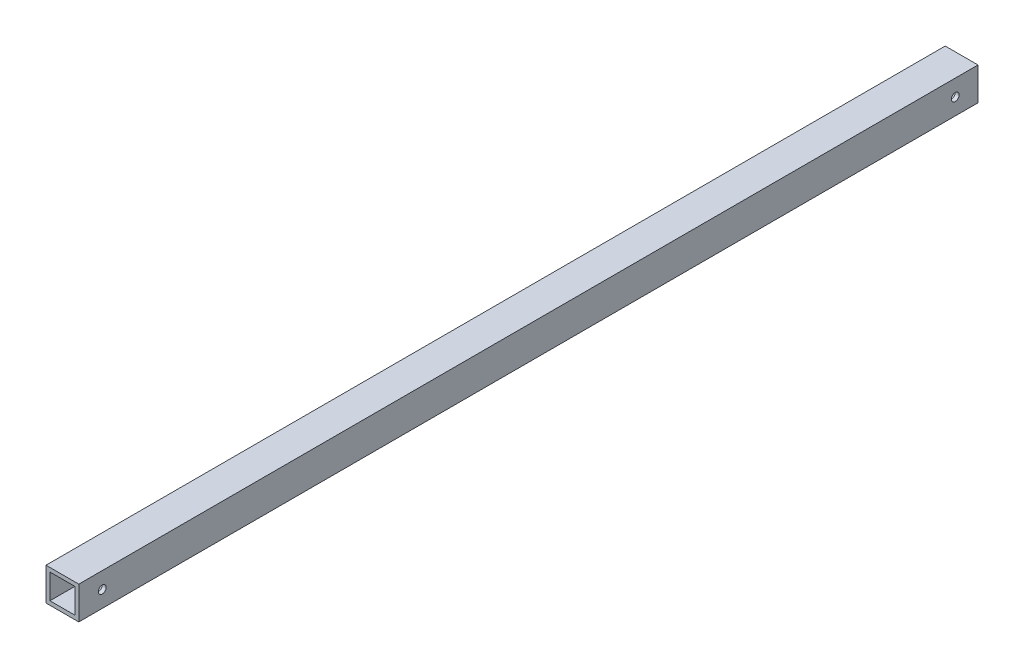
from build123d import *

# Parameters (mm, degrees)
SKETCH_1_W             = 25
SKETCH_1_H             = 25
SKETCH_1_W_2           = 19
SKETCH_1_H_2           = 19
EXTRUDE_1_DEPTH        = 685.5
HOLE_WIZARD_6_0_6_1_D  = 6
CUT_EXTRUDE_1_REACH    = 688.411
SKETCH_5_R             = 6
PATTERN_LINEAR_1_COUNT = 2
PATTERN_LINEAR_1_PITCH = 650.3


with BuildPart() as part:
    # 草图1 → 拉伸1 (new body)
    with BuildSketch(Plane.XY):
        with Locations((12.5, -12.5)):
            Rectangle(SKETCH_1_W, SKETCH_1_H)
        with Locations((12.5, -12.5)):
            Rectangle(SKETCH_1_W_2, SKETCH_1_H_2, mode=Mode.SUBTRACT)
    extrude(amount=EXTRUDE_1_DEPTH)

    # Ø6.0 (6) 直径孔1 (through all)
    with Locations(Plane(origin=(25, 0, 0), x_dir=(0, 0, -1), z_dir=(1, 0, 0))):
        with Locations((-667.65, -12.5)):
            hole_wizard_6_0_6_1 = Hole(HOLE_WIZARD_6_0_6_1_D / 2)

    # 草图5 → 切除-拉伸1 (cut, up to next)
    with BuildSketch(Plane.ZY, mode=Mode.PRIVATE) as cut_extrude_1_sk1:
        with Locations(Location((667.65, -12.5, 0), (0, 0, 270))):
            Circle(SKETCH_5_R)
    cut_extrude_1_tool1 = extrude(cut_extrude_1_sk1.sketch, amount=-CUT_EXTRUDE_1_REACH, mode=Mode.PRIVATE) & part.part
    cut_extrude_1 = cut_extrude_1_tool1.solids().sort_by_distance((0, -12.5, 667.65))[0]
    add(cut_extrude_1, mode=Mode.SUBTRACT)

    # 阵列(线性)1: Ø6.0 (6) 直径孔1, 切除-拉伸1 ×2
    with Locations(*[(0, 0, -i * PATTERN_LINEAR_1_PITCH) for i in range(1, PATTERN_LINEAR_1_COUNT)]):
        add(hole_wizard_6_0_6_1, mode=Mode.SUBTRACT)
        add(cut_extrude_1, mode=Mode.SUBTRACT)


solid = part.part
